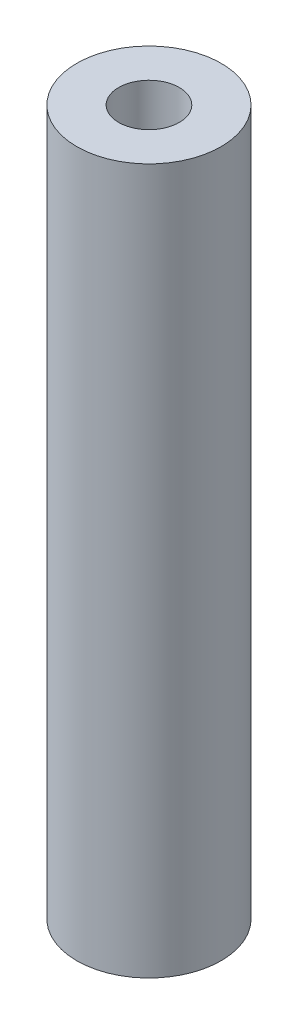
from build123d import *

# Parameters (mm, degrees)
SKETCH1_R           = 6.35
SKETCH1_R_2         = 2.665
BOSS_EXTRUDE1_DEPTH = 62


with BuildPart() as part:
    # Sketch1 → Boss-Extrude1 (new body)
    with BuildSketch(Plane(origin=(0, 0, 0), x_dir=(1, 0, 0), z_dir=(0, 1, 0))):
        with Locations(Location((0, 0, 0), (0, 0, 270))):
            Circle(SKETCH1_R)
        with Locations(Location((0, 0, 0), (0, 0, 270))):
            Circle(SKETCH1_R_2, mode=Mode.SUBTRACT)
    extrude(amount=BOSS_EXTRUDE1_DEPTH)


solid = part.part
